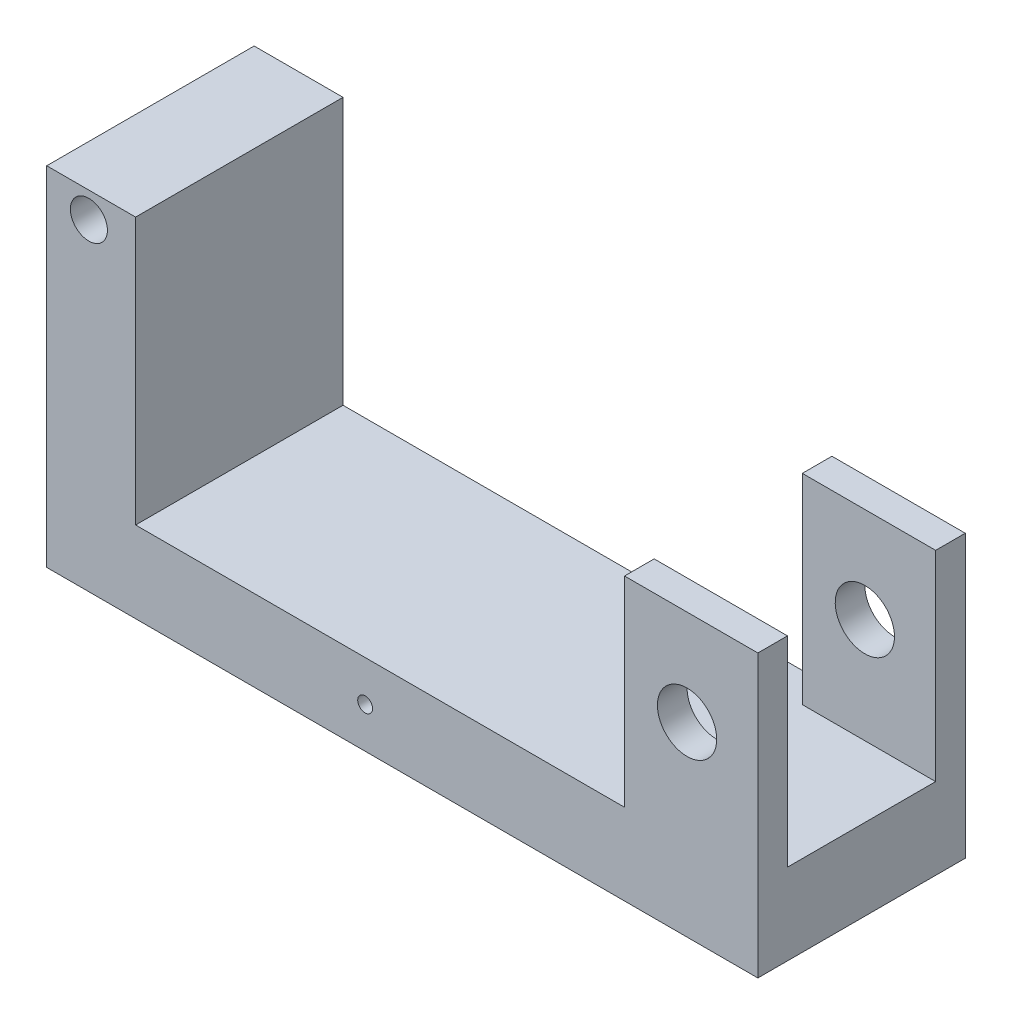
from build123d import *

# Parameters (mm, degrees)
BOSS_EXTRUDE1_DEPTH = 177.8
SKETCH4_R           = 25.4
SKETCH4_R_2         = 15.875
SKETCH4_R_3         = 6.35
CUT_EXTRUDE1_DEPTH  = 462.992536298
SKETCH5_W           = 127
SKETCH5_H           = 171.70338098
CUT_EXTRUDE2_DEPTH  = 605.86044142


with BuildPart() as part:
    # Sketch1 → Boss-Extrude1 (new body)
    with BuildSketch(Plane.XY):
        Polygon((-304.8, 0), (304.8, 0), (304.8, 241.3), (190.5, 241.3), (190.5, 69.59661902), (-228.6, 69.59661902), (-228.6, 298.19661902), (-304.8, 298.19661902), align=None)
    extrude(amount=BOSS_EXTRUDE1_DEPTH)

    # Sketch4 → Cut-Extrude1 (cut, through all)
    with BuildSketch(Plane.XY.offset(177.8)):
        with Locations((244.103977456, 159.533856411)):
            Circle(SKETCH4_R)
        with Locations((-268.663213375, 276.196433082)):
            Circle(SKETCH4_R_2)
        with Locations((-31.867387375, 34.79830951)):
            Circle(SKETCH4_R_3)
    extrude(amount=-CUT_EXTRUDE1_DEPTH, mode=Mode.SUBTRACT)

    # Sketch5 → Cut-Extrude2 (cut, through all)
    with BuildSketch(Plane.ZY.offset(-190.5)):
        with Locations((88.9, 155.44830951)):
            Rectangle(SKETCH5_W, SKETCH5_H)
    extrude(amount=-CUT_EXTRUDE2_DEPTH, mode=Mode.SUBTRACT)


solid = part.part
